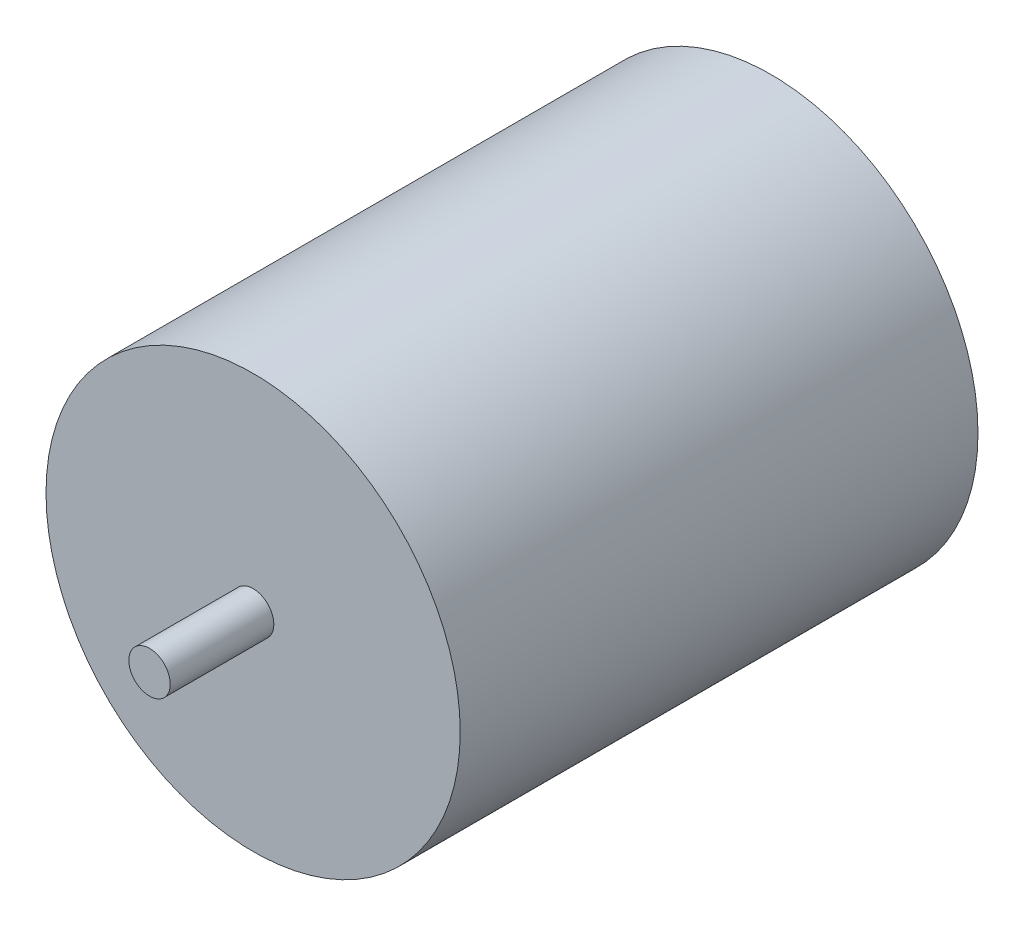
from build123d import *

# Parameters (mm, degrees)
SKETCH1_R           = 12.7
BOSS_EXTRUDE1_DEPTH = 31.75
SKETCH2_R           = 1.27
BOSS_EXTRUDE2_DEPTH = 6.35


with BuildPart() as part:
    # Sketch1 → Boss-Extrude1 (new body)
    with BuildSketch(Plane.XY):
        Circle(SKETCH1_R)
    extrude(amount=BOSS_EXTRUDE1_DEPTH)

    # Sketch2 → Boss-Extrude2 (add)
    with BuildSketch(Plane.XY.offset(31.75)):
        Circle(SKETCH2_R)
    extrude(amount=BOSS_EXTRUDE2_DEPTH)


solid = part.part
